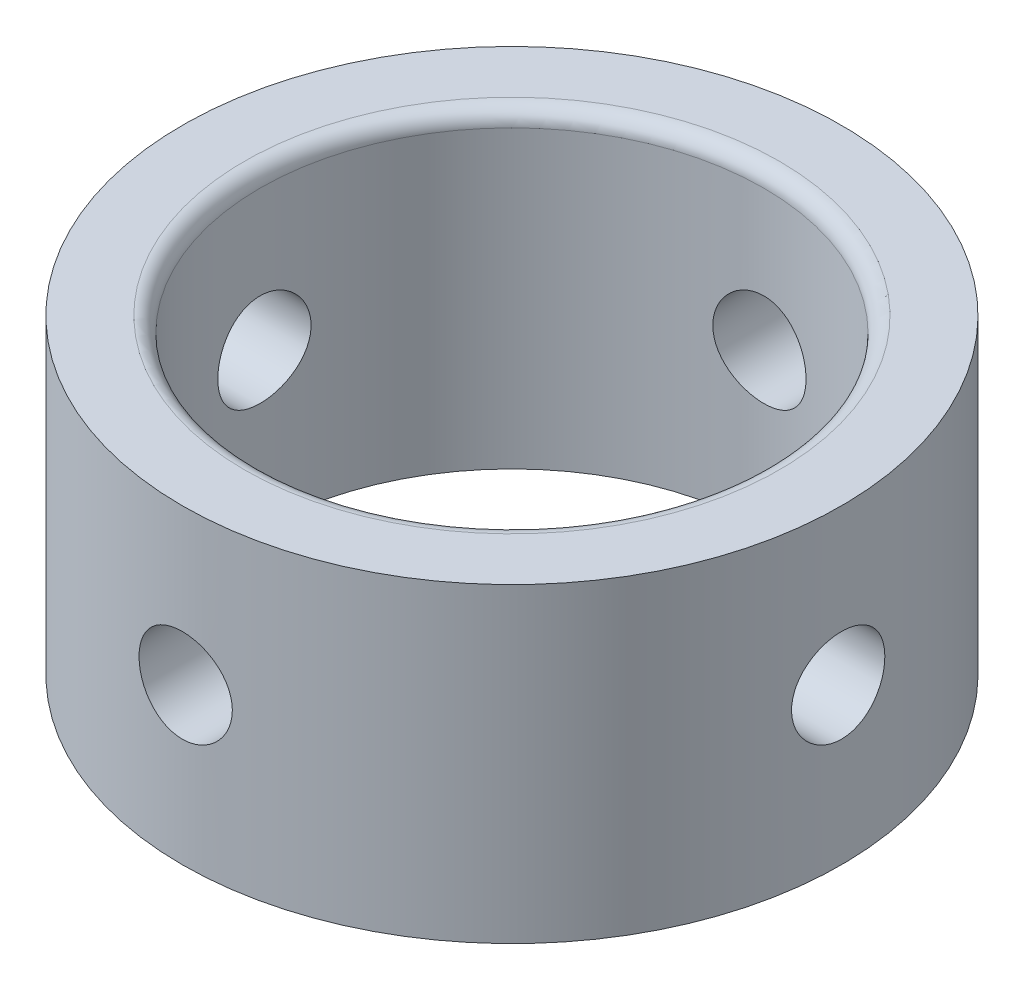
from build123d import *

# Parameters (mm, degrees)
SKETCH1_R           = 21.2
SKETCH1_R_2         = 16.2
BOSS_EXTRUDE1_DEPTH = 20
FILLET1_R           = 1
SKETCH2_R           = 3
CUT_EXTRUDE1_DEPTH  = 10
CIRPATTERN1_COUNT   = 4


with BuildPart() as part:
    # Sketch1 → Boss-Extrude1 (new body)
    with BuildSketch(Plane(origin=(0, 0, 0), x_dir=(1, 0, 0), z_dir=(0, 1, 0))):
        with Locations(Location((0, 0, 0), (0, 0, 270))):
            Circle(SKETCH1_R)
        with Locations(Location((0, 0, 0), (0, 0, 270))):
            Circle(SKETCH1_R_2, mode=Mode.SUBTRACT)
    extrude(amount=BOSS_EXTRUDE1_DEPTH)

    # Fillet1
    fillet1_edges = [part.edges().sort_by_distance(p)[0] for p in [
        (0, 20, -16.2),
    ]]
    fillet(fillet1_edges, radius=FILLET1_R)

    # Sketch2 → Cut-Extrude1 (cut)
    with BuildSketch(Plane(origin=(21.2, 0, 0), x_dir=(0, 0, -1), z_dir=(1, 0, 0))):
        with Locations((0, 10)):
            Circle(SKETCH2_R)
    cut_extrude1 = extrude(amount=-CUT_EXTRUDE1_DEPTH, mode=Mode.SUBTRACT)

    # CirPattern1: Cut-Extrude1 ×4 about axis
    cirpattern1_axis = Axis((0, 19, 0), (0, -1, 0))
    for i in range(1, CIRPATTERN1_COUNT):
        add(cut_extrude1.rotate(cirpattern1_axis, i * 360 / CIRPATTERN1_COUNT), mode=Mode.SUBTRACT)


solid = part.part
